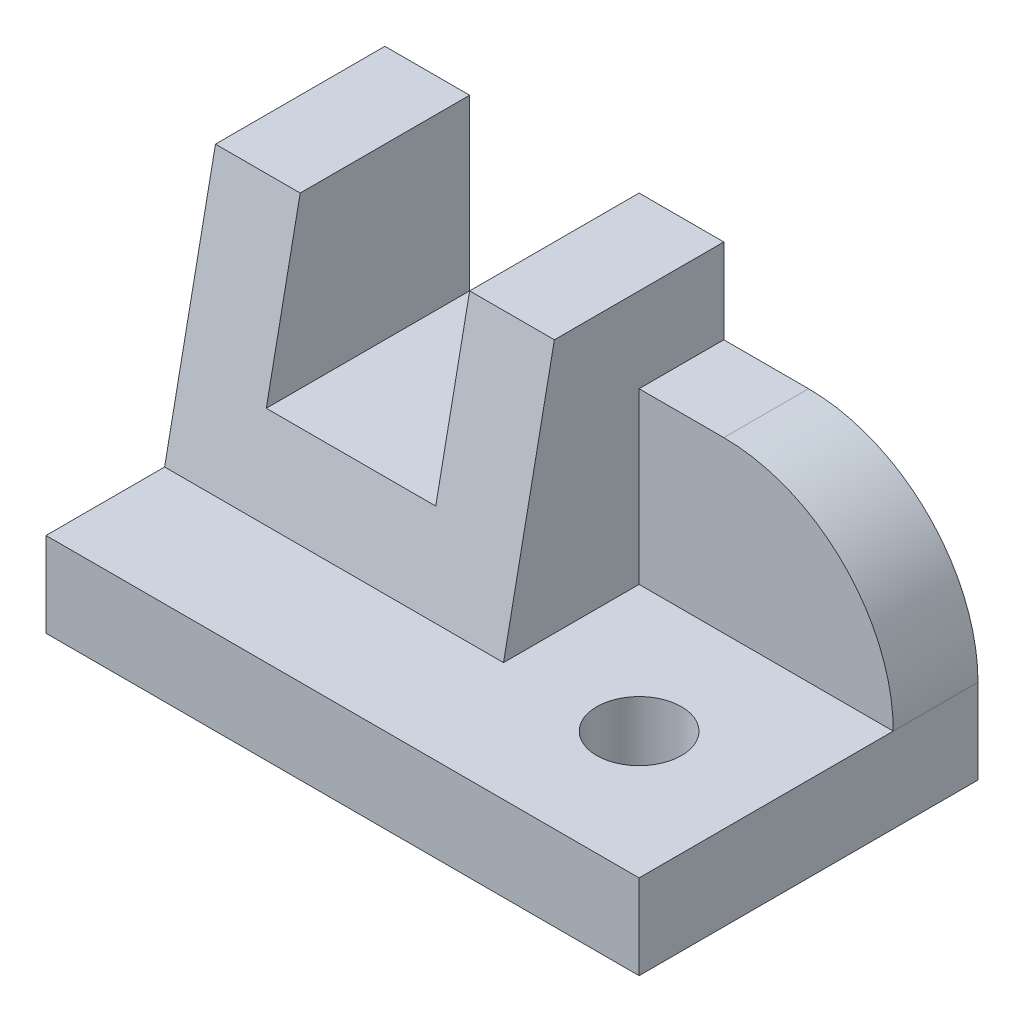
from build123d import *

# Parameters (mm, degrees)
BOSS_EXTRUDE1_DEPTH            = 40
SKETCH2_W                      = 40
SKETCH2_H                      = 30
BOSS_EXTRUDE2_DEPTH            = 20
BOSS_EXTRUDE3_DEPTH            = 30
CUT_EXTRUDE1_DEPTH             = 30
SKETCH5_W                      = 70
SKETCH5_H                      = 40
BOSS_EXTRUDE4_DEPTH            = 10
SKETCH6_W                      = 20
SKETCH6_H                      = 20
CUT_EXTRUDE2_DEPTH             = 91
F_10_0_10_DIAMETER_HOLE1_D     = 10
F_10_0_10_DIAMETER_HOLE1_DEPTH = 40
FILLET1_R                      = 20


with BuildPart() as part:
    # Sketch1 → Boss-Extrude1 (new body)
    with BuildSketch(Plane(origin=(0, 0, 0), x_dir=(0, -1, 0), z_dir=(-1, 0, 0))):
        Polygon((-10, -14), (-40, -20), (-10, -20), align=None)
    extrude(amount=-BOSS_EXTRUDE1_DEPTH)

    # Sketch2 → Boss-Extrude2 (add)
    with BuildSketch(Plane(origin=(0, 0, -20), x_dir=(-1, 0, 0), z_dir=(0, 0, -1))):
        with Locations((-20, 25)):
            Rectangle(SKETCH2_W, SKETCH2_H)
    extrude(amount=BOSS_EXTRUDE2_DEPTH)

    # Sketch3 → Boss-Extrude3 (add)
    with BuildSketch(Plane(origin=(40, 0, 0), x_dir=(0, 0, -1), z_dir=(1, 0, 0))):
        Polygon((40, 10), (0, 10), (20, 40), (40, 40), align=None)
    extrude(amount=BOSS_EXTRUDE3_DEPTH)

    # Sketch4 → Cut-Extrude1 (cut)
    with BuildSketch(Plane(origin=(70, 0, 0), x_dir=(0, 0, -1), z_dir=(1, 0, 0))):
        Polygon((20, 40), (0, 10), (30, 10), (30, 30), (40, 30), (40, 40), align=None)
    extrude(amount=-CUT_EXTRUDE1_DEPTH, mode=Mode.SUBTRACT)

    # Sketch5 → Boss-Extrude4 (add)
    with BuildSketch(Plane.XZ.offset(-10)):
        with Locations((35, -20)):
            Rectangle(SKETCH5_W, SKETCH5_H)
    extrude(amount=BOSS_EXTRUDE4_DEPTH)

    # Sketch6 → Cut-Extrude2 (cut, through all)
    with BuildSketch(Plane(origin=(0, 0, -40), x_dir=(-1, 0, 0), z_dir=(0, 0, -1))):
        with Locations((-20, 30)):
            Rectangle(SKETCH6_W, SKETCH6_H)
    extrude(amount=-CUT_EXTRUDE2_DEPTH, mode=Mode.SUBTRACT)

    # Ø10.0 (10) Diameter Hole1
    with Locations(Plane(origin=(0, 0, 0), x_dir=(-1, 0, 0), z_dir=(0, -1, 0))):
        with Locations((-55, 15)):
            Hole(F_10_0_10_DIAMETER_HOLE1_D / 2, depth=F_10_0_10_DIAMETER_HOLE1_DEPTH)

    # Fillet1
    fillet1_edges = [part.edges().sort_by_distance(p)[0] for p in [
        (70, 30, -35),
    ]]
    fillet(fillet1_edges, radius=FILLET1_R)


solid = part.part
